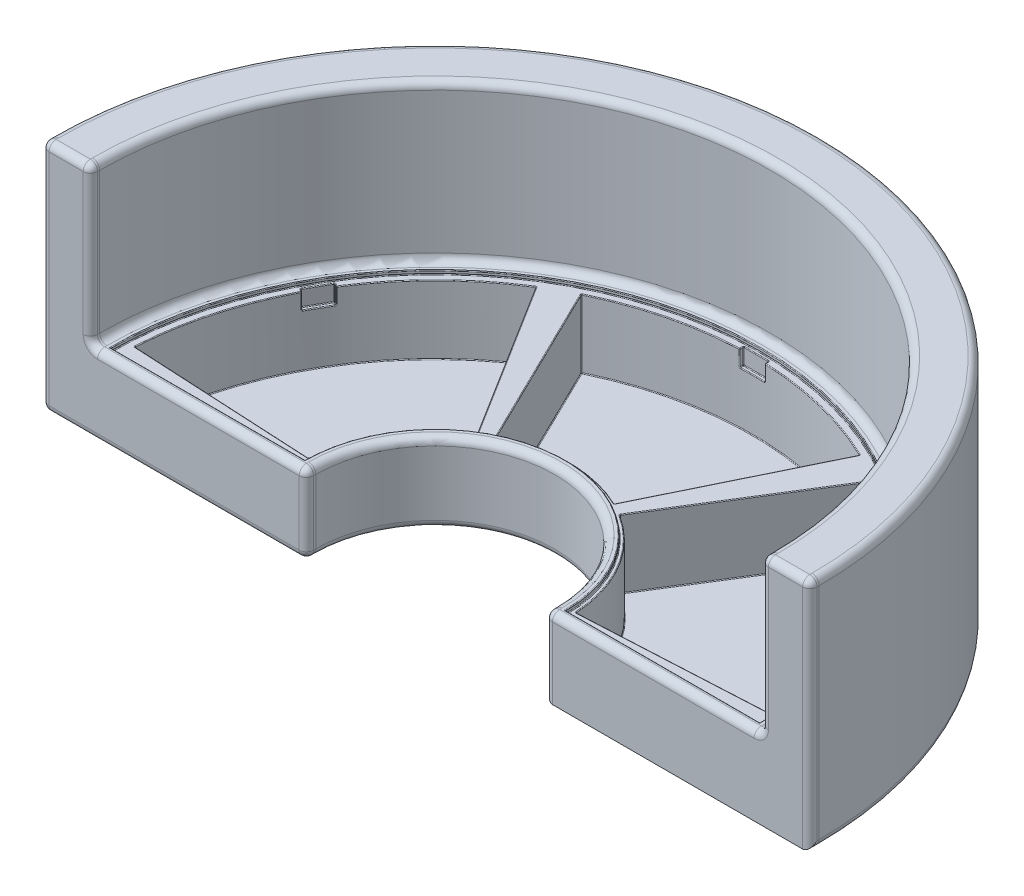
from build123d import *

# Parameters (mm, degrees)
BOSS_EXTRUDE1_DEPTH = 650.4
CUT_REVOLVE1_ANGLE  = 180.0000000000004
BOSS_EXTRUDE2_DEPTH = 26
FILLET1_R           = 20
CUT_EXTRUDE1_DEPTH  = 199.99999999999994
CUT_EXTRUDE2_DEPTH  = 10
CUT_EXTRUDE4_DEPTH  = 45
CIRPATTERN2_COUNT   = 3
CIRPATTERN2_ANGLE   = 120.00000000000027
FILLET2_R           = 2


with BuildPart() as part:
    # Sketch1 → Boss-Extrude1 (new body)
    with BuildSketch(Plane(origin=(0, 0, 0), x_dir=(1, 0, 0), z_dir=(0, 1, 0))):
        with BuildLine():
            Line((-1066.6, 0), (-331.6, 0))
            ThreePointArc((-331.6, 0), (2.03e-14, 331.6), (331.6, 0))
            Line((331.6, 0), (1066.6, 0))
            ThreePointArc((1066.6, 0), (6.531e-14, 1066.6), (-1066.6, 0))
        make_face()
    extrude(amount=BOSS_EXTRUDE1_DEPTH)

    # Sketch4 → Cut-Revolve1 (revolve, cut)
    with BuildSketch(Plane.XY):
        Polygon((-931.6, 650.4), (-931.6, 218.8), (-331.6, 218.79999999999998), (-331.6, 650.4), align=None)
    revolve(axis=Axis((0, 650.4, 0), (0, -1, 0)), revolution_arc=CUT_REVOLVE1_ANGLE, mode=Mode.SUBTRACT)

    # Sketch11 → Boss-Extrude2 (add)
    with BuildSketch(Plane.XY):
        Polygon((-1066.6, 0), (-331.6, 0), (-331.6, 218.79999999999998), (-931.6, 218.8), (-931.6, 650.4), (-1066.6, 650.4), align=None)
    boss_extrude2 = extrude(amount=BOSS_EXTRUDE2_DEPTH)

    # Mirror1: Boss-Extrude2 across plane
    add(boss_extrude2.mirror(Plane(origin=(0, 0, 0), x_dir=(0, 0, 1), z_dir=(1, 0, 0))))

    # Fillet1
    fillet1_edges = [part.edges().sort_by_distance(p)[0] for p in [
        (-4.838e-14, 0, -1066.6),
        (-4.838e-14, 650.4, -1066.6),
        (3.25266e-12, 650.4, -931.6),
        (3.25266e-12, 218.8, -931.6),
        (1.15778e-12, 218.79999999999995, -331.6),
        (8.175e-14, 0, -331.6),
        (1066.6, 650.4, 13),
        (1066.6, 0, 13),
        (-1066.6, 0, 13),
        (-331.6, 0, 13),
        (331.6, 0, 13),
        (331.6, 218.79999999999998, 13),
        (-1066.6, 650.4, 13),
        (931.6, 650.4, 13),
        (-931.6, 650.4, 13),
        (931.6, 218.8, 13),
        (-931.6, 218.8, 13),
        (-331.6, 218.79999999999998, 13),
        (631.6, 218.8, 26),
        (-631.6, 218.8, 26),
        (999.0999999999999, 650.4, 26),
        (931.6, 434.6, 26),
        (1066.6, 325.2, 26),
        (331.6, 109.39999999999999, 26),
        (-331.6, 109.39999999999999, 26),
        (-699.0999999999999, 0, 26),
        (-931.6, 434.6, 26),
        (-1066.6, 325.2, 26),
        (-999.0999999999999, 650.4, 26),
    ]]
    fillet(fillet1_edges, radius=FILLET1_R)

    # Sketch5 → Cut-Extrude1 (cut)
    with BuildSketch(Plane(origin=(0, 218.79999999999998, 0), x_dir=(1, 0, 0), z_dir=(0, 1, 0))):
        with BuildLine():
            Line((-880.3917978396322, 46.13937902377938), (-371.0907351147996, 19.448041339877967))
            ThreePointArc((-371.0907351147996, 19.448041339877967), (-320.1813960200708, 188.60125567619787), (-196.91799858905839, 315.1346725317283))
            Line((-196.91799858905839, 315.1346725317283), (-467.17682334799207, 747.6392015715061))
            ThreePointArc((-467.17682334799207, 747.6392015715061), (-759.6122678452487, 447.44582078615724), (-880.3917978396322, 46.13937902377938))
        make_face()
        with BuildLine():
            Line((371.09073511479977, 19.448041339875445), (880.3917978396325, 46.13937902377339))
            ThreePointArc((880.3917978396325, 46.13937902377339), (759.6122678452514, 447.4458207861529), (467.17682334799633, 747.6392015715033))
            Line((467.17682334799633, 747.6392015715033), (196.9179985890602, 315.1346725317272))
            ThreePointArc((196.9179985890602, 315.1346725317272), (320.18139602007204, 188.601255676196), (371.09073511479977, 19.448041339875445))
        make_face()
        with BuildLine():
            Line((-162.89871814682036, 333.9918676047709), (-386.46800300924866, 792.3768312173465))
            ThreePointArc((-386.46800300924866, 792.3768312173465), (2.40304e-12, 881.5999999999999), (386.4680030092532, 792.3768312173445))
            Line((386.4680030092532, 792.3768312173445), (162.89871814682226, 333.99186760477))
            ThreePointArc((162.89871814682226, 333.99186760477), (1.0129e-12, 371.6), (-162.89871814682036, 333.9918676047709))
        make_face()
    extrude(amount=-CUT_EXTRUDE1_DEPTH, mode=Mode.SUBTRACT)

    # Sketch6 → Cut-Extrude2 (cut)
    with BuildSketch(Plane(origin=(0, 218.79999999999998, 0), x_dir=(1, 0, 0), z_dir=(0, 1, 0))):
        with BuildLine():
            Line((-901.5999999999999, 0), (-361.6, 0))
            ThreePointArc((-361.6, 0), (2.214e-14, 361.6), (361.6, 0))
            Line((361.6, 0), (901.5999999999999, 0))
            ThreePointArc((901.5999999999999, 0), (5.521e-14, 901.5999999999999), (-901.5999999999999, 0))
        make_face()
    extrude(amount=-CUT_EXTRUDE2_DEPTH, mode=Mode.SUBTRACT)

    # Sketch10 → Cut-Extrude4 (cut)
    with BuildSketch(Plane(origin=(0, 208.79999999999998, 0), x_dir=(1, 0, 0), z_dir=(0, 1, 0))):
        Polygon((-745.9879959763604, 471.1108891324562), (-737.327741938516, 466.110889132456), (-772.3277419385159, 405.48911086754555), (-780.9879959763605, 410.4891108675455), (-789.6482500142048, 415.48911086754566), (-754.6482500142049, 476.11088913245607), align=None)
    cut_extrude4 = extrude(amount=-CUT_EXTRUDE4_DEPTH, mode=Mode.SUBTRACT)

    # CirPattern2: Cut-Extrude4 ×3 about axis
    cirpattern2_axis = Axis((1.282e-13, 0, 2.2204e-13), (0, -1, 0))
    for i in range(1, CIRPATTERN2_COUNT):
        add(cut_extrude4.rotate(cirpattern2_axis, i * CIRPATTERN2_ANGLE / (CIRPATTERN2_COUNT - 1)), mode=Mode.SUBTRACT)

    # Fillet2
    fillet2_edges = [part.edges().sort_by_distance(p)[0] for p in [
        (-759.6122678452484, 18.80000000000004, -447.4458207861576),
        (-320.1813960200707, 18.80000000000004, -188.60125567619792),
        (-763.4879959763605, 163.79999999999998, -440.80000000000086),
        (-745.386079306733, 186.29999999999998, -470.7633723812171),
        (-780.3860793067331, 186.29999999999998, -410.1415941163064),
        (-1.64e-15, 218.79999999999998, -901.5999999999999),
        (6.28e-15, 218.79999999999998, -361.6),
        (-320.1813960200707, 208.79999999999998, -188.60125567619784),
        (-371.0907351147996, 113.80000000000001, -19.448041339877967),
        (-631.5999999999999, 208.79999999999998, 0),
        (-880.3917978396323, 113.80000000000001, -46.139379023779426),
        (-850.1001073125219, 208.79999999999998, -233.55591952943226),
        (-621.8860461700867, 208.79999999999998, -624.8810331406585),
        (-467.1768233479921, 113.80000000000001, -747.6392015715062),
        (-332.04741096852524, 208.79999999999998, -531.3869370516172),
        (-196.91799858905836, 113.80000000000001, -315.13467253172826),
        (-625.741266477216, 18.80000000000004, -32.79371018182867),
        (-332.04741096852524, 18.80000000000004, -531.3869370516172),
        (1.07292e-12, 208.79999999999998, -371.6000000000001),
        (-162.89871814682033, 113.80000000000001, -333.99186760477096),
        (-274.6833605780345, 208.79999999999998, -563.1843494110587),
        (-386.4680030092487, 113.80000000000001, -792.3768312173465),
        (-215.3325964042569, 208.79999999999998, -854.8979078964935),
        (-34.99999999999665, 186.29999999999998, -880.904966497522),
        (2.85638e-12, 163.79999999999998, -881.6000000000001),
        (35.00000000000337, 186.29999999999998, -880.9049664975217),
        (215.3325964042624, 208.79999999999998, -854.8979078964921),
        (386.46800300925327, 113.80000000000001, -792.3768312173445),
        (274.68336057803776, 208.79999999999998, -563.1843494110573),
        (162.89871814682226, 113.80000000000001, -333.99186760477005),
        (-274.6833605780345, 18.80000000000004, -563.1843494110587),
        (2.51532e-12, 18.80000000000004, -881.6000000000001),
        (274.68336057803776, 18.80000000000004, -563.1843494110573),
        (1.07292e-12, 18.80000000000004, -371.6000000000001),
        (320.181396020072, 208.79999999999998, -188.6012556761959),
        (196.9179985890602, 113.80000000000001, -315.13467253172723),
        (332.0474109685283, 208.79999999999998, -531.3869370516153),
        (467.17682334799633, 113.80000000000001, -747.6392015715033),
        (621.886046170091, 208.79999999999998, -624.8810331406544),
        (745.3860793067369, 186.29999999999998, -470.76337238121175),
        (763.487995976364, 163.79999999999998, -440.7999999999953),
        (780.3860793067364, 186.29999999999998, -410.1415941163008),
        (850.1001073125237, 208.79999999999998, -233.55591952942615),
        (880.3917978396325, 113.80000000000001, -46.13937902377339),
        (371.0907351147998, 113.80000000000001, -19.448041339875438),
        (332.04741096852825, 18.80000000000004, -531.3869370516153),
        (759.6122678452516, 18.80000000000004, -447.4458207861529),
        (625.7412664772162, 18.80000000000004, -32.793710181824416),
        (320.181396020072, 18.80000000000004, -188.601255676196),
        (789.648250014208, 186.29999999999998, -415.48911086753986),
        (772.1482500142083, 163.79999999999998, -445.7999999999952),
        (754.6482500142085, 186.29999999999998, -476.11088913245044),
        (-34.99999999999645, 163.79999999999998, -886.2524832487611),
        (35.000000000003155, 163.79999999999998, -886.2524832487608),
        (35.00000000000327, 186.29999999999998, -891.5999999999997),
        (3.38278e-12, 163.79999999999998, -891.5999999999999),
        (-34.99999999999645, 186.29999999999998, -891.6),
        (-750.017164660469, 163.79999999999998, -473.4371307568365),
        (-785.0171646604689, 163.79999999999998, -412.81535249192615),
        (-754.6482500142049, 186.29999999999998, -476.11088913245607),
        (-772.1482500142049, 163.79999999999998, -445.80000000000086),
        (-789.6482500142048, 186.29999999999998, -415.48911086754566),
        (750.0171646604725, 208.79999999999998, -473.4371307568309),
        (6.28e-15, 208.79999999999998, -361.6),
        (-750.0171646604688, 208.79999999999998, -473.4371307568364),
        (-772.1482500142049, 208.79999999999998, -445.80000000000086),
        (-785.0171646604693, 208.79999999999998, -412.8153524919263),
        (-1.64e-15, 208.79999999999998, -901.5999999999999),
        (785.0171646604725, 208.79999999999998, -412.8153524919205),
        (772.1482500142083, 208.79999999999998, -445.7999999999952),
        (-34.999999999996504, 208.79999999999998, -886.2524832487607),
        (35.00000000000321, 208.79999999999998, -886.2524832487604),
        (3.38278e-12, 208.79999999999998, -891.5999999999999),
        (625.7412664772162, 208.79999999999998, -32.79371018182441),
        (-625.741266477216, 208.79999999999998, -32.79371018182866),
        (631.5999999999999, 218.79999999999998, 0),
        (-631.5999999999999, 218.79999999999998, 0),
    ]]
    fillet(fillet2_edges, radius=FILLET2_R)


solid = part.part
